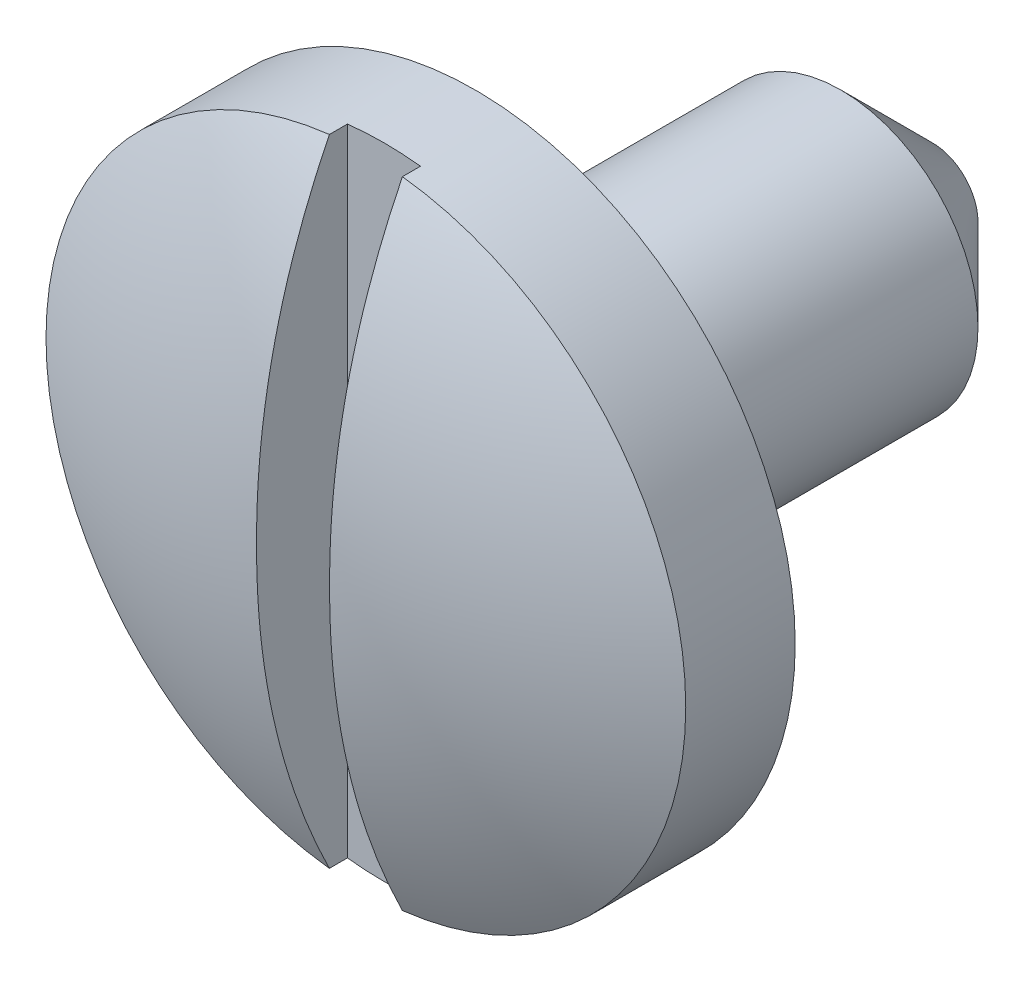
from build123d import *

# Parameters (mm, degrees)
SKETCH_1_R          = 3.5
EXTRUDE_1_DEPTH     = 2
SKETCH_2_W          = 0.799406376
SKETCH_2_H          = 7.454929226
CUT_EXTRUDE_1_DEPTH = 1
SKETCH_3_R          = 1.5
EXTRUDE_2_DEPTH     = 5
CHAMFER_1_SIZE      = 1


with BuildPart() as part:
    # Эскиз1 → Бобышка-Вытянуть1 (new body)
    with BuildSketch(Plane.XY):
        Circle(SKETCH_1_R)
    extrude(amount=EXTRUDE_1_DEPTH)

    # Эскиз2 → Вырез-Вытянуть1 (cut)
    with BuildSketch(Plane.XY.offset(2)):
        Rectangle(SKETCH_2_W, SKETCH_2_H)
    extrude(amount=-CUT_EXTRUDE_1_DEPTH, mode=Mode.SUBTRACT)

    # Эскиз3 → Бобышка-Вытянуть2 (add)
    with BuildSketch(Plane(origin=(0, 0, 0), x_dir=(-1, 0, 0), z_dir=(0, 0, -1))):
        Circle(SKETCH_3_R)
    extrude(amount=EXTRUDE_2_DEPTH)

    # Фаска1
    chamfer_1_edges = [part.edges().sort_by_distance(p)[0] for p in [
        (1.5, 0, -5),
    ]]
    chamfer(chamfer_1_edges, length=CHAMFER_1_SIZE)

    # Эскиз6 → Вырез-Повернуть3 (revolve, cut)
    with BuildSketch(Plane(origin=(0, 0, 0), x_dir=(1, 0, 0), z_dir=(0, 1, 0))):
        with BuildLine():
            Line((0.1, -2), (3.503572085, -2))
            Line((3.503572085, -2), (3.503572085, -1.195824387))
            ThreePointArc((3.503572085, -1.195824387), (1.848642427, -1.796225946), (0.1, -2))
        make_face()
    revolve(axis=Axis((0, 0, 4.44135275), (0, 0, -1)), mode=Mode.SUBTRACT)


solid = part.part
